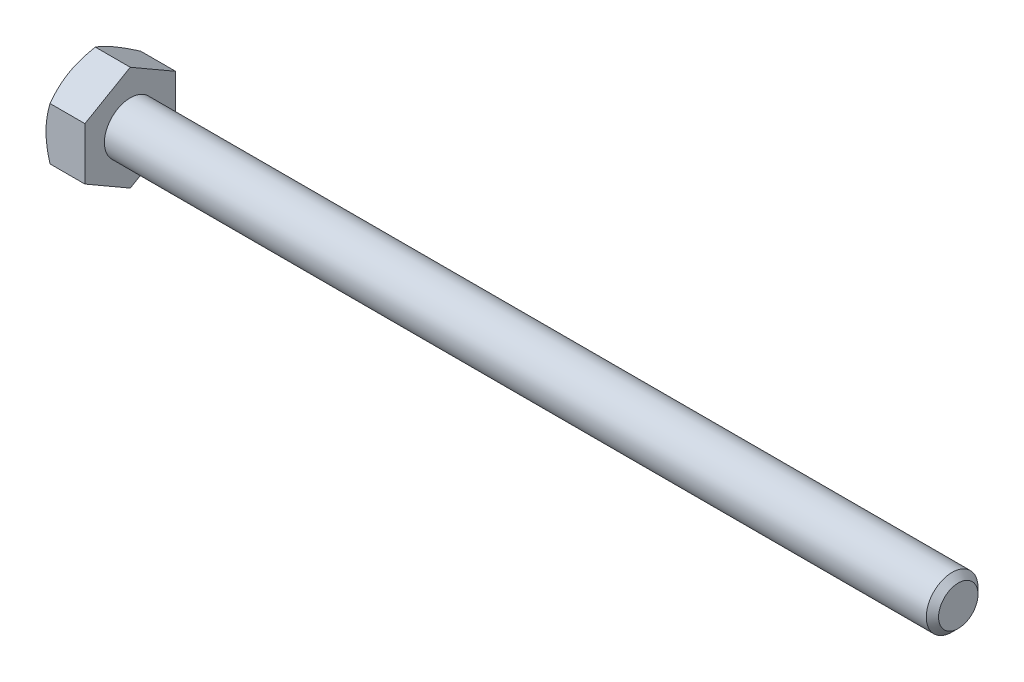
from build123d import *

# Parameters (mm, degrees)
BASEHEAD_DEPTH = 4.7752


with BuildPart() as part:
    # Sketch1 → BaseHead (new body)
    with BuildSketch(Plane(origin=(0, 0, 0), x_dir=(0, 0, -1), z_dir=(1, 0, 0))):
        Polygon((5.5626, 3.211568607), (5.5626, -3.211568607), (0, -6.423137215), (-5.5626, -3.211568607), (-5.5626, 3.211568607), (0, 6.423137215), align=None)
    extrude(amount=BASEHEAD_DEPTH)

    # BodySke → BaseBody (revolve)
    with BuildSketch(Plane.XY, mode=Mode.PRIVATE) as basebody_sk:
        Polygon((0, 0), (106.3752, 0), (106.3752, 2.41935), (105.61955, 3.175), (0, 3.175), align=None)
    revolve(basebody_sk.sketch.rotate(Axis((0, 0, 0), (1, 0, 0)), 90), axis=Axis((0, 0, 0), (1, 0, 0)))

    # Sketch3 → HeadChamfer (revolve, cut)
    with BuildSketch(Plane.XY):
        Polygon((0, 5.5626), (4.163005602, 12.773137215), (4.163005602, 19.123137215), (-12.7, 19.123137215), (-12.7, 5.5626), align=None)
    revolve(axis=Axis((0, 0, 0), (1, 0, 0)), mode=Mode.SUBTRACT)


solid = part.part
